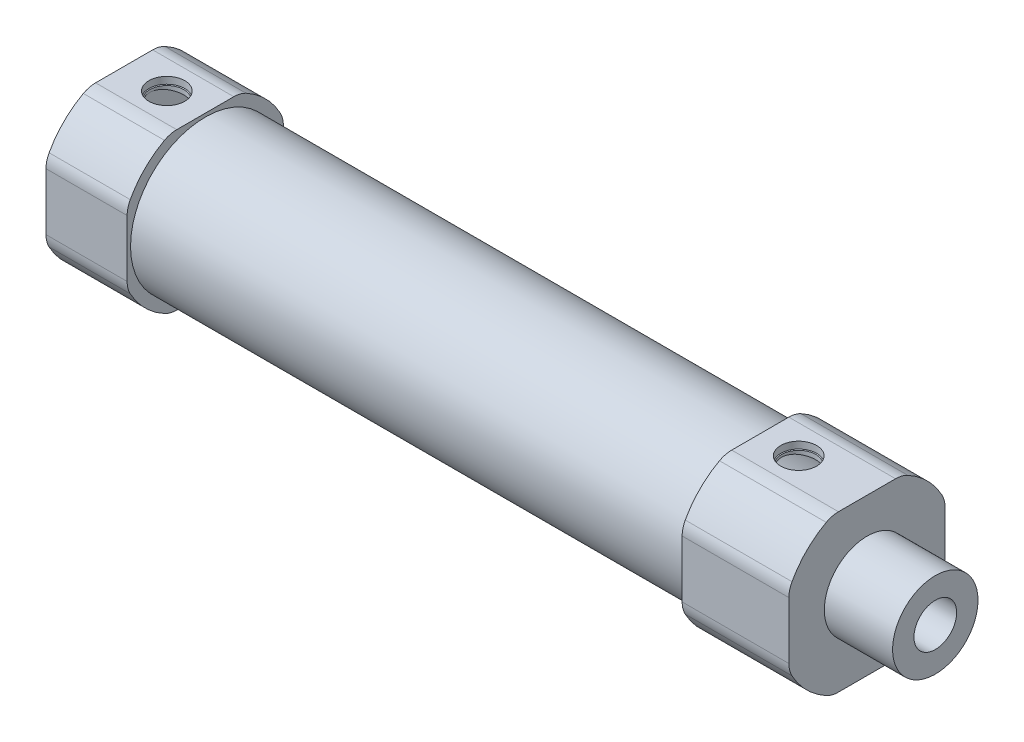
from build123d import *

# Parameters (mm, degrees)
SKETCH_473_R           = 8.75
EXTRUDE_520_DEPTH      = 87
EXTRUDE_START          = -12.5
SKETCH_1_R             = 8.75
EXTRUDE_922_DEPTH      = 12.5
SKETCH_1_2_R           = 8.75
EXTRUDE_1386_DEPTH     = 9.5
SKETCH_1_3_R           = 2
CUT_EXTRUDE_1653_DEPTH = 10
HOLE_WIZARD_1692_D     = 4.2
HOLE_WIZARD_1692_DEPTH = 0.8
HOLE_WIZARD_1692_TIP   = 1.2618073
CUT_EXTRUDE_START      = -3
SKETCH_1_4_R           = 8
CUT_EXTRUDE_3_DEPTH    = 81
SKETCH_1_5_R           = 5
EXTRUDE_2765_DEPTH     = 8
CUT_EXTRUDE_2995_REACH = 97.877
SKETCH_1_6_R           = 2.5
FILLET_2_R             = 3
FILLET_3_R             = 3


with BuildPart() as part:
    # Sketch 473 → Extrude 520 (new body)
    with BuildSketch(Plane(origin=(0, 0, 0), x_dir=(0, 0, -1), z_dir=(1, 0, 0))):
        Circle(SKETCH_473_R)
    extrude(amount=EXTRUDE_520_DEPTH)

    # Sketch 1 → Extrude 922 (add)
    with BuildSketch(Plane(origin=(87, 0, 0), x_dir=(0, 0, -1), z_dir=(1, 0, 0)).offset(EXTRUDE_START)):
        with BuildLine():
            Line((4.034538387, 9.15), (-4.034538387, 9.15))
            ThreePointArc((-4.034538387, 9.15), (-7.071067812, 7.071067812), (-9.15, 4.034538387))
            Line((-9.15, 4.034538387), (-9.15, -4.034538387))
            ThreePointArc((-9.15, -4.034538387), (-7.071067812, -7.071067812), (-4.034538387, -9.15))
            Line((-4.034538387, -9.15), (4.034538387, -9.15))
            ThreePointArc((4.034538387, -9.15), (7.071067812, -7.071067812), (9.15, -4.034538387))
            Line((9.15, -4.034538387), (9.15, 4.034538387))
            ThreePointArc((9.15, 4.034538387), (7.071067812, 7.071067812), (4.034538387, 9.15))
        make_face()
        Circle(SKETCH_1_R, mode=Mode.SUBTRACT)
    extrude(amount=EXTRUDE_922_DEPTH)

    # Sketch 1 2 → Extrude 1386 (add)
    with BuildSketch(Plane.ZY):
        with BuildLine():
            Line((4.034538387, 9.15), (-4.034538387, 9.15))
            ThreePointArc((-4.034538387, 9.15), (-7.071067812, 7.071067812), (-9.15, 4.034538387))
            Line((-9.15, 4.034538387), (-9.15, -4.034538387))
            ThreePointArc((-9.15, -4.034538387), (-7.071067812, -7.071067812), (-4.034538387, -9.15))
            Line((-4.034538387, -9.15), (4.034538387, -9.15))
            ThreePointArc((4.034538387, -9.15), (7.071067812, -7.071067812), (9.15, -4.034538387))
            Line((9.15, -4.034538387), (9.15, 4.034538387))
            ThreePointArc((9.15, 4.034538387), (7.071067812, 7.071067812), (4.034538387, 9.15))
        make_face()
        Circle(SKETCH_1_2_R, mode=Mode.SUBTRACT)
    extrude(amount=-EXTRUDE_1386_DEPTH)

    # Sketch 1 3 → Cut-Extrude 1653 (cut)
    with BuildSketch(Plane(origin=(0, 9.15, 0), x_dir=(1, 0, 0), z_dir=(0, 1, 0))):
        with Locations(Location((5, 0, 0), (0, 0, 270))):
            Circle(SKETCH_1_3_R)
        with Locations(Location((79, 0, 0), (0, 0, 270))):
            Circle(SKETCH_1_3_R)
    extrude(amount=-CUT_EXTRUDE_1653_DEPTH, mode=Mode.SUBTRACT)

    # Hole Wizard 1692
    with Locations(Plane(origin=(5, 9.15, 0), x_dir=(0, 0, 1), z_dir=(0, 1, 0))):
        with Locations((0, 0), (0, 74)):
            Hole(HOLE_WIZARD_1692_D / 2, depth=HOLE_WIZARD_1692_DEPTH)
            with Locations((0, 0, -(HOLE_WIZARD_1692_DEPTH + HOLE_WIZARD_1692_TIP / 2))):  # 118° drill point
                Cone(0, HOLE_WIZARD_1692_D / 2, HOLE_WIZARD_1692_TIP, mode=Mode.SUBTRACT)

    # Sketch 1 4 → 切除-拉伸3 (cut)
    with BuildSketch(Plane(origin=(87, 0, 0), x_dir=(0, 0, -1), z_dir=(1, 0, 0)).offset(CUT_EXTRUDE_START)):
        Circle(SKETCH_1_4_R)
    extrude(amount=-CUT_EXTRUDE_3_DEPTH, mode=Mode.SUBTRACT)

    # Sketch 1 5 → Extrude 2765 (add)
    with BuildSketch(Plane(origin=(87, 0, 0), x_dir=(0, 0, -1), z_dir=(1, 0, 0))):
        Circle(SKETCH_1_5_R)
    extrude(amount=EXTRUDE_2765_DEPTH)

    # Sketch 1 6 → Cut-Extrude 2995 (cut, up to next)
    with BuildSketch(Plane(origin=(95, 0, 0), x_dir=(0, 0, -1), z_dir=(1, 0, 0)), mode=Mode.PRIVATE) as cut_extrude_2995_sk1:
        Circle(SKETCH_1_6_R)
    cut_extrude_2995_tool1 = extrude(cut_extrude_2995_sk1.sketch, amount=-CUT_EXTRUDE_2995_REACH, mode=Mode.PRIVATE) & part.part
    add(cut_extrude_2995_tool1.solids().sort_by_distance((95, 0, 0))[0], mode=Mode.SUBTRACT)

    # 圆角2
    fillet_2_edges = [part.edges().sort_by_distance(p)[0] for p in [
        (4.75, 4.034538387, 9.15),
        (4.75, -4.034538387, 9.15),
        (4.75, -9.15, 4.034538387),
        (4.75, -9.15, -4.034538387),
        (4.75, -4.034538387, -9.15),
        (4.75, 4.034538387, -9.15),
        (4.75, 9.15, -4.034538387),
        (4.75, 9.15, 4.034538387),
    ]]
    fillet(fillet_2_edges, radius=FILLET_2_R)

    # 圆角3
    fillet_3_edges = [part.edges().sort_by_distance(p)[0] for p in [
        (80.75, 4.034538387, -9.15),
        (80.75, -4.034538387, -9.15),
        (80.75, -9.15, -4.034538387),
        (80.75, -9.15, 4.034538387),
        (80.75, -4.034538387, 9.15),
        (80.75, 4.034538387, 9.15),
        (80.75, 9.15, 4.034538387),
        (80.75, 9.15, -4.034538387),
    ]]
    fillet(fillet_3_edges, radius=FILLET_3_R)


solid = part.part
